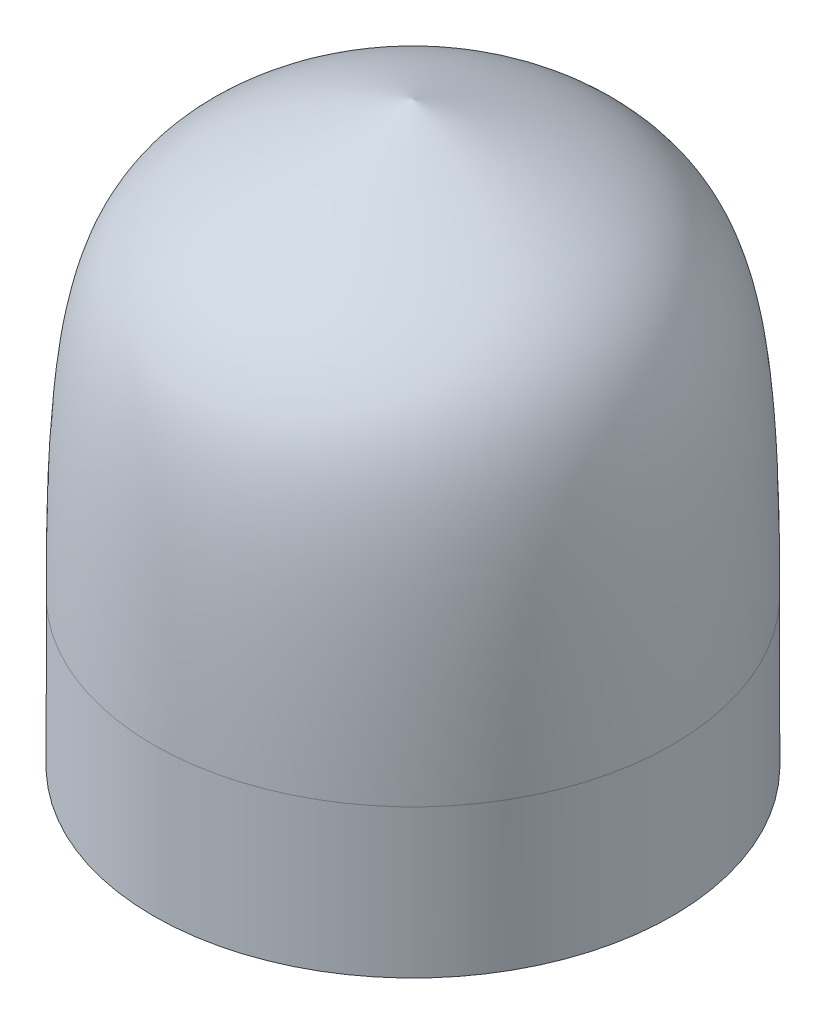
from build123d import *

# Parameters (mm, degrees)
SKETCH6_R           = 8.89
BOSS_EXTRUDE8_DEPTH = 5.08


with BuildPart() as part:
    # Sketch6 → Boss-Extrude8 (new body)
    with BuildSketch(Plane(origin=(0, 0, 0), x_dir=(1, 0, 0), z_dir=(0, 1, 0))):
        with Locations(Location((0, 0, 0), (0, 0, 270))):
            Circle(SKETCH6_R)
    extrude(amount=BOSS_EXTRUDE8_DEPTH)

    # Sketch8 → Revolve3 (revolve)
    with BuildSketch(Plane.XY):
        with BuildLine():
            Line((0, 5.08), (0, 19.791590025))
            add(Edge.make_bspline(
                [(-8.89, 5.08), (-8.89, 16.800836864), (0, 19.791590025)],
                knots=[0, 0, 0, 1, 1, 1], degree=2, weights=[1, 2.333333333, 1]))
            Line((-8.89, 5.08), (0, 5.08))
        make_face()
    revolve(axis=Axis((0, 5.08, 0), (0, 1, 0)))


solid = part.part
